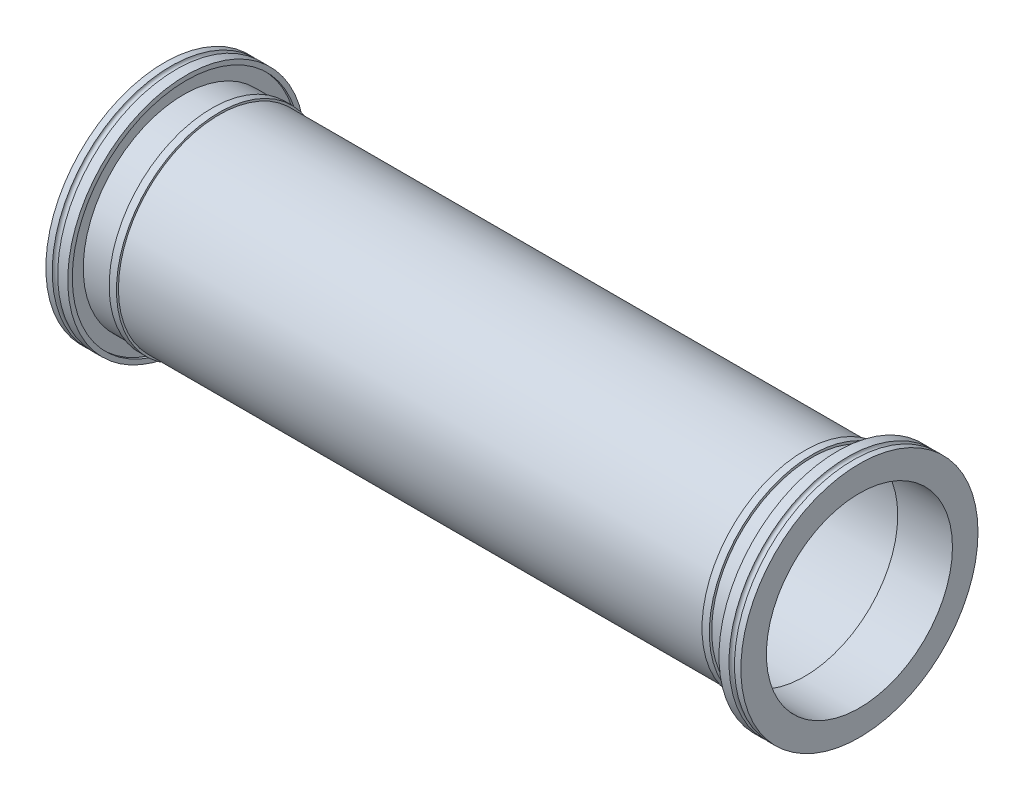
from build123d import *

# Parameters (mm, degrees)
EXTRUDE_THIN1_START = 160.5026
SKETCH3_R           = 55.2
SKETCH3_R_2         = 55
EXTRUDE_THIN1_DEPTH = 160.5026


with BuildPart() as part:
    # Sketch2 → Revolve2 (revolve)
    with BuildSketch(Plane.XY):
        with BuildLine():
            Line((0, -51), (0, -65))
            Line((0, -65), (3.5, -65))
            ThreePointArc((3.5, -65), (5, -63.5), (6.5, -65))
            Line((6.5, -65), (12, -65))
            Line((12, -65), (12, -62.5))
            Line((12, -62.5), (10.5, -62.5))
            Line((10.5, -62.5), (10.5, -55))
            Line((10.5, -55), (26, -55))
            Line((26, -55), (26, -56.3))
            Line((26, -56.3), (30, -56.3))
            Line((30, -56.3), (30, -51))
            Line((30, -51), (0, -51))
        make_face()
    revolve2 = revolve(axis=Axis((400.5834, 0, 0), (-1, 0, 0)))

    # Sketch3 → Extrude-Thin1 (add)
    with BuildSketch(Plane(origin=(30, 0, 0), x_dir=(0, 0, -1), z_dir=(1, 0, 0)).offset(EXTRUDE_THIN1_START)):
        Circle(SKETCH3_R)
        Circle(SKETCH3_R_2, mode=Mode.SUBTRACT)
    extrude_thin1 = extrude(amount=-EXTRUDE_THIN1_DEPTH)

    # Mirror1: Revolve2, Extrude-Thin1 across plane
    add(revolve2.mirror(Plane(origin=(190.5026, 0, 0), x_dir=(0, 0, 1), z_dir=(1, 0, 0))))
    add(extrude_thin1.mirror(Plane(origin=(190.5026, 0, 0), x_dir=(0, 0, 1), z_dir=(1, 0, 0))))


solid = part.part
